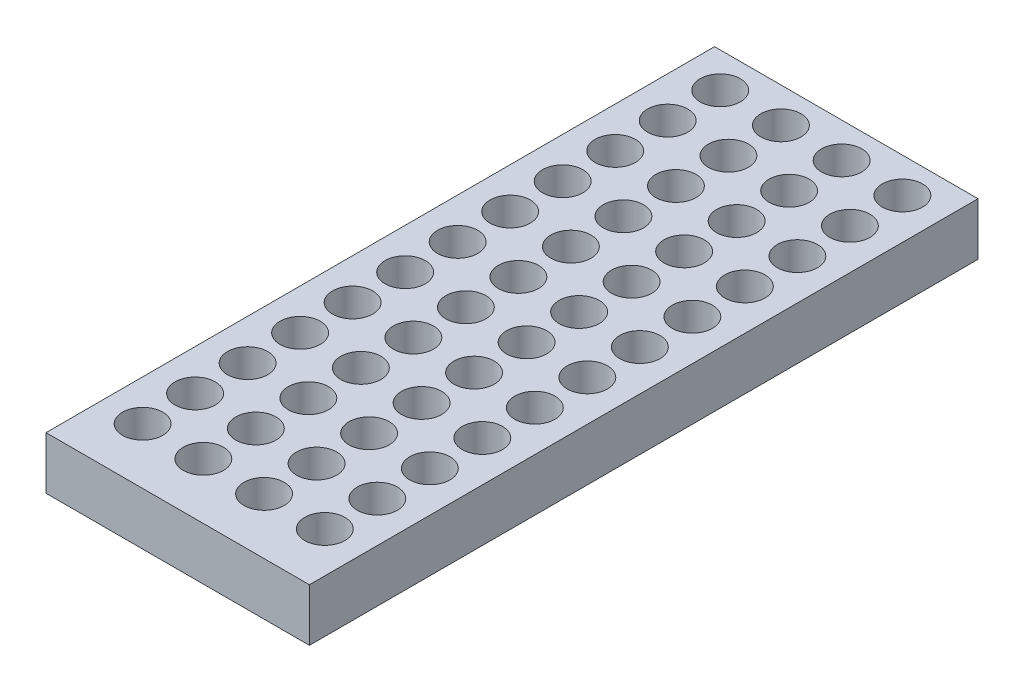
from build123d import *

# Parameters (mm, degrees)
SKETCH1_W           = 75.25
SKETCH1_H           = 191
SKETCH1_R           = 5.75
BOSS_EXTRUDE1_DEPTH = 15


with BuildPart() as part:
    # Sketch1 → Boss-Extrude1 (new body)
    with BuildSketch(Plane(origin=(0, 0, 0), x_dir=(1, 0, 0), z_dir=(0, 1, 0))):
        Rectangle(SKETCH1_W, SKETCH1_H)
        with Locations(Location((-26.025, 85.5, 0), (0, 0, 270))):
            Circle(SKETCH1_R, mode=Mode.SUBTRACT)
        with Locations(Location((-8.675, 85.5, 0), (0, 0, 270))):
            Circle(SKETCH1_R, mode=Mode.SUBTRACT)
        with Locations(Location((8.675, 85.5, 0), (0, 0, 270))):
            Circle(SKETCH1_R, mode=Mode.SUBTRACT)
        with Locations(Location((26.025, 85.5, 0), (0, 0, 270))):
            Circle(SKETCH1_R, mode=Mode.SUBTRACT)
        with Locations(Location((-26.025, 70.5, 0), (0, 0, 270))):
            Circle(SKETCH1_R, mode=Mode.SUBTRACT)
        with Locations(Location((-8.675, 70.5, 0), (0, 0, 270))):
            Circle(SKETCH1_R, mode=Mode.SUBTRACT)
        with Locations(Location((8.675, 70.5, 0), (0, 0, 270))):
            Circle(SKETCH1_R, mode=Mode.SUBTRACT)
        with Locations(Location((26.025, 70.5, 0), (0, 0, 270))):
            Circle(SKETCH1_R, mode=Mode.SUBTRACT)
        with Locations(Location((-26.025, 55.5, 0), (0, 0, 270))):
            Circle(SKETCH1_R, mode=Mode.SUBTRACT)
        with Locations(Location((-8.675, 55.5, 0), (0, 0, 270))):
            Circle(SKETCH1_R, mode=Mode.SUBTRACT)
        with Locations(Location((8.675, 55.5, 0), (0, 0, 270))):
            Circle(SKETCH1_R, mode=Mode.SUBTRACT)
        with Locations(Location((26.025, 55.5, 0), (0, 0, 270))):
            Circle(SKETCH1_R, mode=Mode.SUBTRACT)
        with Locations(Location((-26.025, 40.5, 0), (0, 0, 270))):
            Circle(SKETCH1_R, mode=Mode.SUBTRACT)
        with Locations(Location((-8.675, 40.5, 0), (0, 0, 270))):
            Circle(SKETCH1_R, mode=Mode.SUBTRACT)
        with Locations(Location((8.675, 40.5, 0), (0, 0, 270))):
            Circle(SKETCH1_R, mode=Mode.SUBTRACT)
        with Locations(Location((26.025, 40.5, 0), (0, 0, 270))):
            Circle(SKETCH1_R, mode=Mode.SUBTRACT)
        with Locations(Location((-26.025, 25.5, 0), (0, 0, 270))):
            Circle(SKETCH1_R, mode=Mode.SUBTRACT)
        with Locations(Location((-8.675, 25.5, 0), (0, 0, 270))):
            Circle(SKETCH1_R, mode=Mode.SUBTRACT)
        with Locations(Location((8.675, 25.5, 0), (0, 0, 270))):
            Circle(SKETCH1_R, mode=Mode.SUBTRACT)
        with Locations(Location((26.025, 25.5, 0), (0, 0, 270))):
            Circle(SKETCH1_R, mode=Mode.SUBTRACT)
        with Locations(Location((-26.025, 10.5, 0), (0, 0, 270))):
            Circle(SKETCH1_R, mode=Mode.SUBTRACT)
        with Locations(Location((-8.675, 10.5, 0), (0, 0, 270))):
            Circle(SKETCH1_R, mode=Mode.SUBTRACT)
        with Locations(Location((8.675, 10.5, 0), (0, 0, 270))):
            Circle(SKETCH1_R, mode=Mode.SUBTRACT)
        with Locations(Location((26.025, 10.5, 0), (0, 0, 270))):
            Circle(SKETCH1_R, mode=Mode.SUBTRACT)
        with Locations(Location((-26.025, -4.5, 0), (0, 0, 270))):
            Circle(SKETCH1_R, mode=Mode.SUBTRACT)
        with Locations(Location((-8.675, -4.5, 0), (0, 0, 270))):
            Circle(SKETCH1_R, mode=Mode.SUBTRACT)
        with Locations(Location((8.675, -4.5, 0), (0, 0, 270))):
            Circle(SKETCH1_R, mode=Mode.SUBTRACT)
        with Locations(Location((26.025, -4.5, 0), (0, 0, 270))):
            Circle(SKETCH1_R, mode=Mode.SUBTRACT)
        with Locations(Location((-26.025, -19.5, 0), (0, 0, 270))):
            Circle(SKETCH1_R, mode=Mode.SUBTRACT)
        with Locations(Location((-8.675, -19.5, 0), (0, 0, 270))):
            Circle(SKETCH1_R, mode=Mode.SUBTRACT)
        with Locations(Location((8.675, -19.5, 0), (0, 0, 270))):
            Circle(SKETCH1_R, mode=Mode.SUBTRACT)
        with Locations(Location((26.025, -19.5, 0), (0, 0, 270))):
            Circle(SKETCH1_R, mode=Mode.SUBTRACT)
        with Locations(Location((-26.025, -34.5, 0), (0, 0, 270))):
            Circle(SKETCH1_R, mode=Mode.SUBTRACT)
        with Locations(Location((-8.675, -34.5, 0), (0, 0, 270))):
            Circle(SKETCH1_R, mode=Mode.SUBTRACT)
        with Locations(Location((8.675, -34.5, 0), (0, 0, 270))):
            Circle(SKETCH1_R, mode=Mode.SUBTRACT)
        with Locations(Location((26.025, -34.5, 0), (0, 0, 270))):
            Circle(SKETCH1_R, mode=Mode.SUBTRACT)
        with Locations(Location((-26.025, -49.5, 0), (0, 0, 270))):
            Circle(SKETCH1_R, mode=Mode.SUBTRACT)
        with Locations(Location((-8.675, -49.5, 0), (0, 0, 270))):
            Circle(SKETCH1_R, mode=Mode.SUBTRACT)
        with Locations(Location((8.675, -49.5, 0), (0, 0, 270))):
            Circle(SKETCH1_R, mode=Mode.SUBTRACT)
        with Locations(Location((26.025, -49.5, 0), (0, 0, 270))):
            Circle(SKETCH1_R, mode=Mode.SUBTRACT)
        with Locations(Location((-26.025, -64.5, 0), (0, 0, 270))):
            Circle(SKETCH1_R, mode=Mode.SUBTRACT)
        with Locations(Location((-8.675, -64.5, 0), (0, 0, 270))):
            Circle(SKETCH1_R, mode=Mode.SUBTRACT)
        with Locations(Location((8.675, -64.5, 0), (0, 0, 270))):
            Circle(SKETCH1_R, mode=Mode.SUBTRACT)
        with Locations(Location((26.025, -64.5, 0), (0, 0, 270))):
            Circle(SKETCH1_R, mode=Mode.SUBTRACT)
        with Locations(Location((-26.025, -79.5, 0), (0, 0, 270))):
            Circle(SKETCH1_R, mode=Mode.SUBTRACT)
        with Locations(Location((-8.675, -79.5, 0), (0, 0, 270))):
            Circle(SKETCH1_R, mode=Mode.SUBTRACT)
        with Locations(Location((8.675, -79.5, 0), (0, 0, 270))):
            Circle(SKETCH1_R, mode=Mode.SUBTRACT)
        with Locations(Location((26.025, -79.5, 0), (0, 0, 270))):
            Circle(SKETCH1_R, mode=Mode.SUBTRACT)
    extrude(amount=BOSS_EXTRUDE1_DEPTH)


solid = part.part
